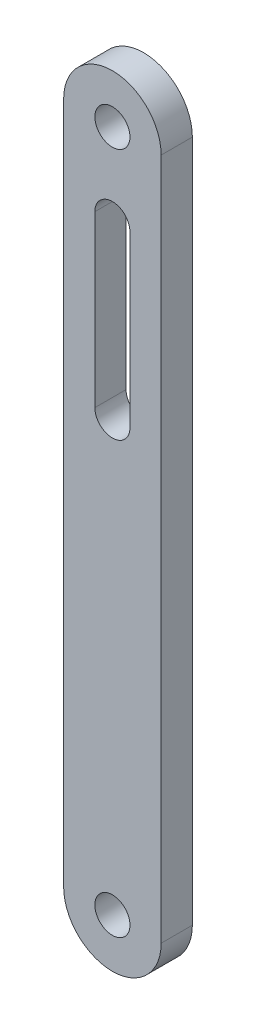
from build123d import *

# Parameters (mm, degrees)
SKETCH1_R           = 1.8
BOSS_EXTRUDE1_DEPTH = 3.2


with BuildPart() as part:
    # Sketch1 → Boss-Extrude1 (new body)
    with BuildSketch(Plane.XY):
        with BuildLine():
            Line((-5, -35), (-5, 35))
            ThreePointArc((-5, 35), (0, 40), (5, 35))
            Line((5, 35), (5, -35))
            ThreePointArc((5, -35), (0, -40), (-5, -35))
        make_face()
        with Locations((0, 35)):
            Circle(SKETCH1_R, mode=Mode.SUBTRACT)
        with Locations((0, -35)):
            Circle(SKETCH1_R, mode=Mode.SUBTRACT)
        with BuildLine():
            Line((1.8, 26.574427131), (1.8, 9.170584538))
            ThreePointArc((1.8, 9.170584538), (0, 7.370584538), (-1.8, 9.170584538))
            Line((-1.8, 9.170584538), (-1.8, 26.574427131))
            ThreePointArc((-1.8, 26.574427131), (0, 28.374427131), (1.8, 26.574427131))
        make_face(mode=Mode.SUBTRACT)
    extrude(amount=BOSS_EXTRUDE1_DEPTH)


solid = part.part
